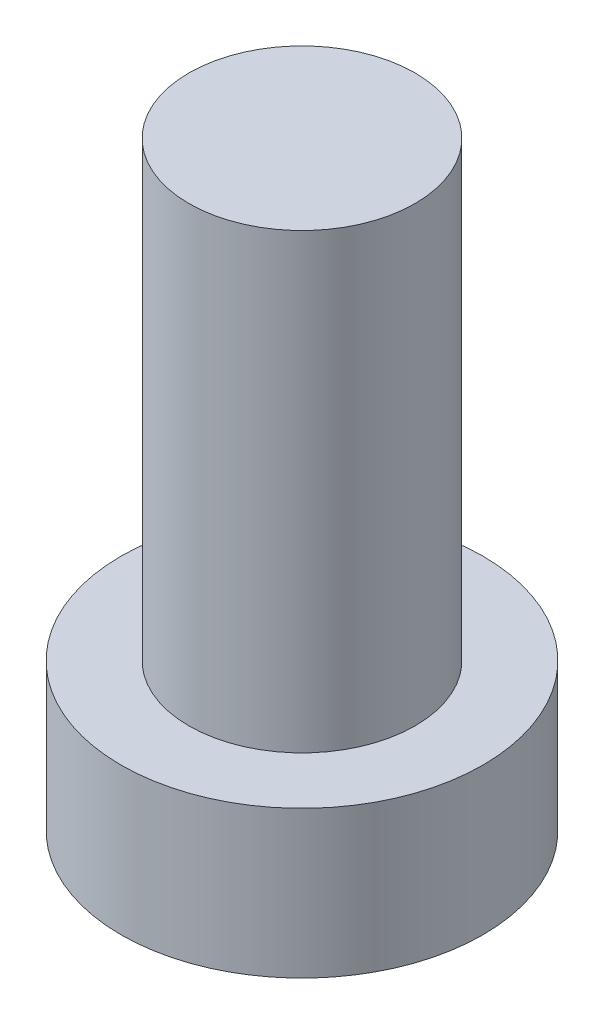
from build123d import *

# Parameters (mm, degrees)
SKETCH_1_R      = 1.6
EXTRUDE_1_DEPTH = 1.3
EXTRUDE_START   = 1.3
SKETCH_2_R      = 1
EXTRUDE_2_DEPTH = 4


with BuildPart() as part:
    # 草图1 → 凸台-拉伸1 (new body)
    with BuildSketch(Plane(origin=(0, 0, 0), x_dir=(1, 0, 0), z_dir=(0, 1, 0))):
        with Locations(Location((0, 0, 0), (0, 0, 270))):
            Circle(SKETCH_1_R)
    extrude(amount=EXTRUDE_1_DEPTH)

    # 草图2 → 凸台-拉伸2 (add)
    with BuildSketch(Plane(origin=(0, 0, 0), x_dir=(1, 0, 0), z_dir=(0, 1, 0)).offset(EXTRUDE_START)):
        with Locations(Location((0, 0, 0), (0, 0, 270))):
            Circle(SKETCH_2_R)
    extrude(amount=EXTRUDE_2_DEPTH)


solid = part.part
